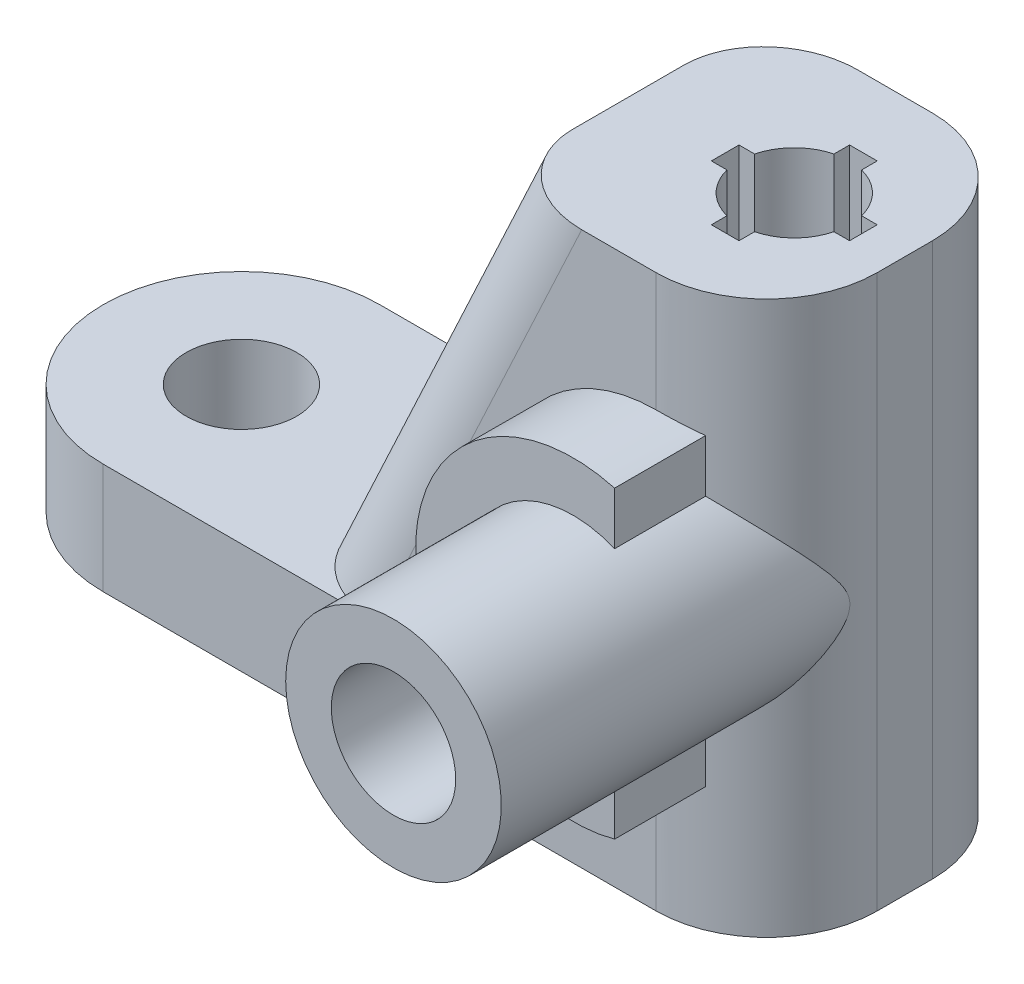
from build123d import *

# Parameters (mm, degrees)
SKETCH1_W                            = 30
SKETCH1_H                            = 20
BOSS_EXTRUDE1_DEPTH                  = 10
SKETCH3_R                            = 2
CUT_EXTRUDE1_DEPTH                   = 27.925824036
SKETCH4_R                            = 2
CUT_EXTRUDE2_DEPTH                   = 27.925824036
FILLET1_R                            = 4
SKETCH5_R                            = 3.9
BOSS_EXTRUDE2_DEPTH                  = 9.5
BOSS_EXTRUDE2_DIRECTION_2_REACH      = 22.616
BOSS_EXTRUDE2_DIRECTION_2_END_RADIUS = 4
CUT_EXTRUDE3_DEPTH                   = 21.615528249
FILLET3_R                            = 3
BOSS_EXTRUDE3_START                  = -0.291901
BOSS_EXTRUDE3_DEPTH                  = 3.291901
SKETCH8_R                            = 2.25
CUT_EXTRUDE4_DEPTH                   = 8
CUT_EXTRUDE5_DEPTH                   = 32.705677897
CUT_EXTRUDE6_DEPTH                   = 32.705677897


with BuildPart() as part:
    # Sketch1 → Boss-Extrude1 (new body)
    with BuildSketch(Plane.XY):
        Rectangle(SKETCH1_W, SKETCH1_H)
    extrude(amount=BOSS_EXTRUDE1_DEPTH)

    # Sketch3 → Cut-Extrude1 (cut, through all)
    with BuildSketch(Plane(origin=(0, 10, 0), x_dir=(1, 0, 0), z_dir=(0, 1, 0))):
        with Locations(Location((11, -5, 0), (0, 0, 270))):
            Circle(SKETCH3_R)
    extrude(amount=-CUT_EXTRUDE1_DEPTH, mode=Mode.SUBTRACT)

    # Sketch4 → Cut-Extrude2 (cut, through all)
    with BuildSketch(Plane.XZ.offset(10)):
        with Locations(Location((-9, 5, 0), (0, 0, 270))):
            Circle(SKETCH4_R)
    extrude(amount=-CUT_EXTRUDE2_DEPTH, mode=Mode.SUBTRACT)

    # Fillet1
    fillet1_edges = [part.edges().sort_by_distance(p)[0] for p in [
        (15, 0, 10),
        (15, 0, 0),
    ]]
    fillet(fillet1_edges, radius=FILLET1_R)

    # Sketch5 → Boss-Extrude2 (add)
    with BuildSketch(Plane.XY.offset(10)):
        with Locations(Location((11, 0, 0), (0, 0, 180))):
            Circle(SKETCH5_R)
    extrude(amount=BOSS_EXTRUDE2_DEPTH)

    # Boss-Extrude2 direction 2: up to this cylinder (the profile starts outside it)
    boss_extrude2_direction_2_end = Plane(origin=(11, 0, 6), z_dir=(0, -1, 0)) * Cylinder(BOSS_EXTRUDE2_DIRECTION_2_END_RADIUS, 54.232, mode=Mode.PRIVATE)
    # Sketch5 → Boss-Extrude2 direction 2 (add, up to the surface)
    with BuildSketch(Plane.XY.offset(10), mode=Mode.PRIVATE) as boss_extrude2_direction_2_sk1:
        with Locations(Location((11, 0, 0), (0, 0, 180))):
            Circle(SKETCH5_R)
    boss_extrude2_direction_2_tool1 = extrude(boss_extrude2_direction_2_sk1.sketch, amount=-BOSS_EXTRUDE2_DIRECTION_2_REACH, mode=Mode.PRIVATE) - boss_extrude2_direction_2_end
    add(boss_extrude2_direction_2_tool1.solids().sort_by_distance((11, 0, 10))[0])
    add(boss_extrude2_direction_2_tool1.solids().sort_by_distance((11, 0, 10))[1])

    # Sketch6 → Cut-Extrude3 (cut, through all)
    with BuildSketch(Plane.XY.offset(10)):
        Polygon((-15, -6), (-2.46092253, -6), (5, 10), (-15, 10), align=None)
    extrude(amount=-CUT_EXTRUDE3_DEPTH, mode=Mode.SUBTRACT)

    # Fillet3
    fillet3_edges = [part.edges().sort_by_distance(p)[0] for p in [
        (1.269538735, 2, 0),
        (1.269538735, 2, 10),
    ]]
    fillet(fillet3_edges, radius=FILLET3_R)

    # Sketch7 → Boss-Extrude3 (add)
    with BuildSketch(Plane.XY.offset(10).offset(BOSS_EXTRUDE3_START)):
        with BuildLine():
            Line((12.5, 5.499090834), (12.5, -5.499090834))
            ThreePointArc((12.5, -5.499090834), (5.3, 0), (12.5, 5.499090834))
        make_face()
    extrude(amount=BOSS_EXTRUDE3_DEPTH)

    # Sketch8 → Cut-Extrude4 (cut)
    with BuildSketch(Plane.XY.offset(19.5)):
        with Locations((11, 0)):
            Circle(SKETCH8_R)
    extrude(amount=-CUT_EXTRUDE4_DEPTH, mode=Mode.SUBTRACT)

    # Sketch9 → Cut-Extrude5 (cut, through all)
    with BuildSketch(Plane.XZ.offset(10)):
        with BuildLine():
            Line((-9, 10), (-15, 10))
            Line((-15, 10), (-15, 0))
            Line((-15, 0), (-9, 0))
            ThreePointArc((-9, 0), (-14, 5), (-9, 10))
        make_face()
    extrude(amount=-CUT_EXTRUDE5_DEPTH, mode=Mode.SUBTRACT)

    # Sketch10 → Cut-Extrude6 (cut, through all)
    with BuildSketch(Plane(origin=(0, 10, 0), x_dir=(1, 0, 0), z_dir=(0, 1, 0))):
        with BuildLine():
            Line((8.5, -4.5), (9.063508327, -4.5))
            ThreePointArc((9.063508327, -4.5), (9.015940607, -4.747991415), (9, -5))
            ThreePointArc((9, -5), (9.015940607, -5.252008585), (9.063508327, -5.5))
            Line((9.063508327, -5.5), (8.5, -5.5))
            Line((8.5, -5.5), (8.5, -4.5))
        make_face()
        with BuildLine():
            Line((10.5, -2.5), (10.5, -3.063508327))
            ThreePointArc((10.5, -3.063508327), (10.747991415, -3.015940607), (11, -3))
            ThreePointArc((11, -3), (11.252008585, -3.015940607), (11.5, -3.063508327))
            Line((11.5, -3.063508327), (11.5, -2.5))
            Line((11.5, -2.5), (10.5, -2.5))
        make_face()
        with BuildLine():
            Line((13.5, -4.5), (12.936491673, -4.5))
            ThreePointArc((12.936491673, -4.5), (12.984059393, -4.747991415), (13, -5))
            ThreePointArc((13, -5), (12.984059393, -5.252008585), (12.936491673, -5.5))
            Line((12.936491673, -5.5), (13.5, -5.5))
            Line((13.5, -5.5), (13.5, -4.5))
        make_face()
        with BuildLine():
            Line((11.5, -7.5), (11.5, -6.936491673))
            ThreePointArc((11.5, -6.936491673), (11.252008585, -6.984059393), (11, -7))
            ThreePointArc((11, -7), (10.747991415, -6.984059393), (10.5, -6.936491673))
            Line((10.5, -6.936491673), (10.5, -7.5))
            Line((10.5, -7.5), (11.5, -7.5))
        make_face()
    extrude(amount=-CUT_EXTRUDE6_DEPTH, mode=Mode.SUBTRACT)


solid = part.part
